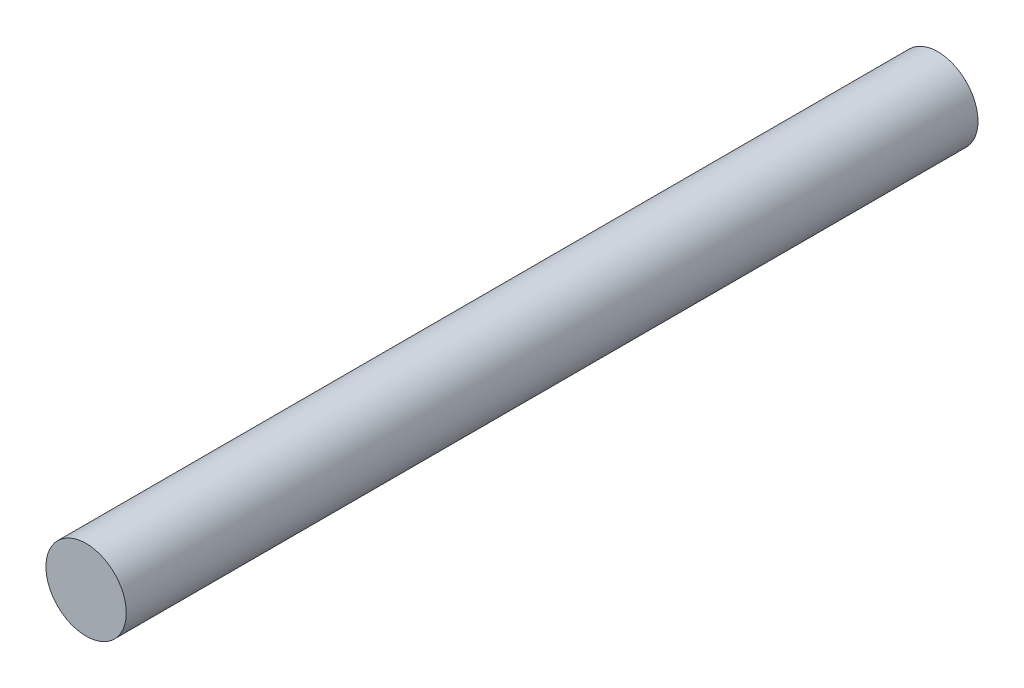
from build123d import *

# Parameters (mm, degrees)
SKETCH1_R           = 2.5
BOSS_EXTRUDE1_DEPTH = 53


with BuildPart() as part:
    # Sketch1 → Boss-Extrude1 (new body)
    with BuildSketch(Plane.XY):
        Circle(SKETCH1_R)
    extrude(amount=BOSS_EXTRUDE1_DEPTH)


solid = part.part
